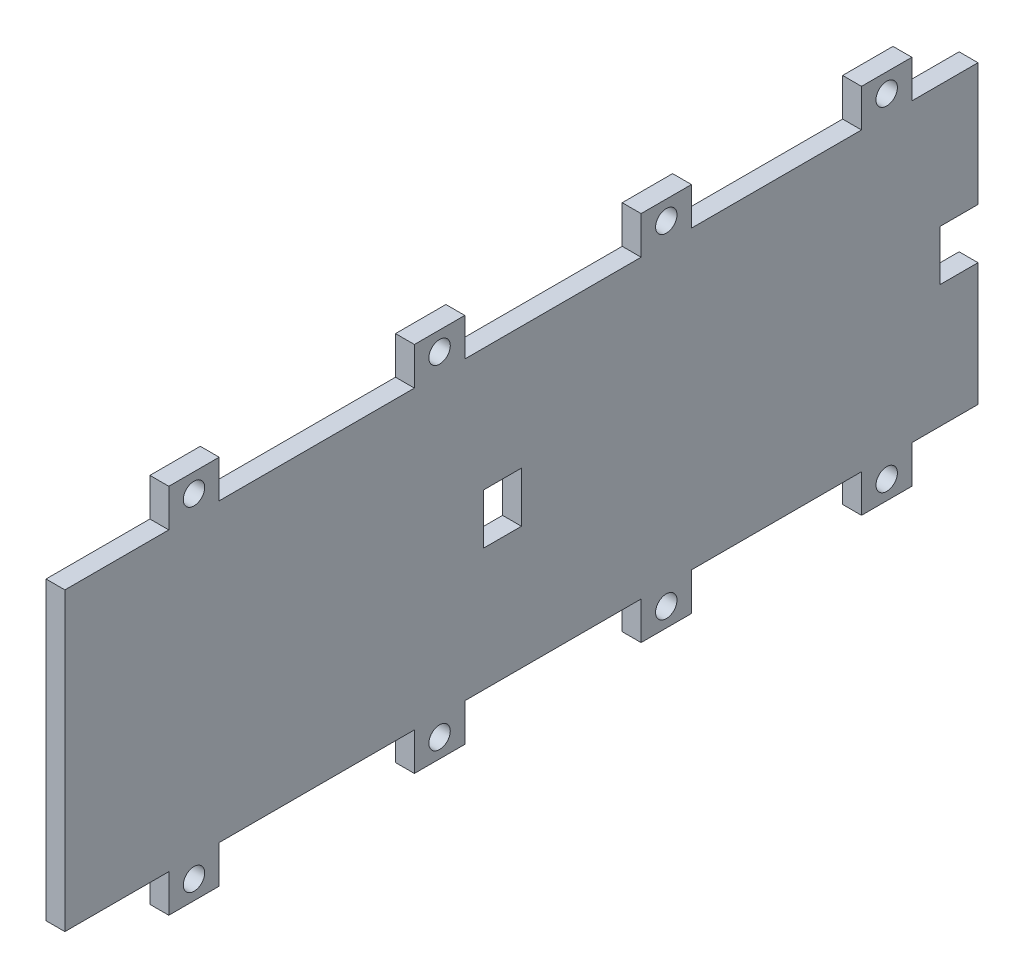
from build123d import *

# Parameters (mm, degrees)
EXTRUDE_START   = 11
SKETCH_1_R      = 1.7
SKETCH_1_W      = 6
SKETCH_1_H      = 8
EXTRUDE_1_DEPTH = 3


with BuildPart() as part:
    # 草圖1 → 填料-伸長1 (new body)
    with BuildSketch(Plane(origin=(0, 0, 0), x_dir=(0, 0, -1), z_dir=(1, 0, 0)).offset(EXTRUDE_START)):
        Polygon((-10.5, 23.5), (-21, 23.5), (-21, 29.5), (-29, 29.5), (-29, 23.5), (-56, 23.5), (-56, 29.5), (-64, 29.5), (-64, 23.5), (-92, 23.5), (-92, 29.5), (-100, 29.5), (-100, 23.5), (-131, 23.5), (-131, 29.5), (-139, 29.5), (-139, 23.5), (-155.5, 23.5), (-155.5, -23.5), (-139, -23.5), (-139, -29.5), (-131, -29.5), (-131, -23.5), (-100, -23.5), (-100, -29.5), (-92, -29.5), (-92, -23.5), (-64, -23.5), (-64, -29.5), (-56, -29.5), (-56, -23.5), (-29, -23.5), (-29, -29.5), (-21, -29.5), (-21, -23.5), (-10.5, -23.5), (-10.5, -4), (-16.5, -4), (-16.5, 4), (-10.5, 4), align=None)
        with Locations((-25, 26.5)):
            Circle(SKETCH_1_R, mode=Mode.SUBTRACT)
        with Locations((-25, -26.5)):
            Circle(SKETCH_1_R, mode=Mode.SUBTRACT)
        with Locations((-60, 26.5)):
            Circle(SKETCH_1_R, mode=Mode.SUBTRACT)
        with Locations((-60, -26.5)):
            Circle(SKETCH_1_R, mode=Mode.SUBTRACT)
        with Locations((-96, 26.5)):
            Circle(SKETCH_1_R, mode=Mode.SUBTRACT)
        with Locations((-96, -26.5)):
            Circle(SKETCH_1_R, mode=Mode.SUBTRACT)
        with Locations((-135, 26.5)):
            Circle(SKETCH_1_R, mode=Mode.SUBTRACT)
        with Locations((-135, -26.5)):
            Circle(SKETCH_1_R, mode=Mode.SUBTRACT)
        with Locations((-86, 0)):
            Rectangle(SKETCH_1_W, SKETCH_1_H, mode=Mode.SUBTRACT)
    extrude(amount=EXTRUDE_1_DEPTH)


solid = part.part
